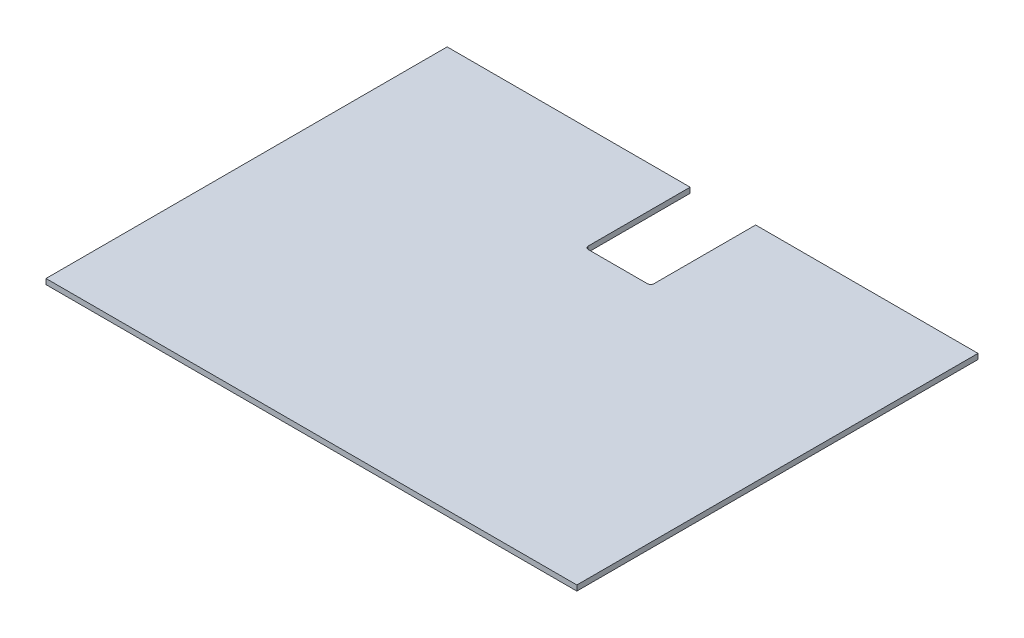
from build123d import *

# Parameters (mm, degrees)
SKETCH_1_W          = 794
SKETCH_1_H          = 8
EXTRUDE_1_DEPTH     = 600
CUT_EXTRUDE_1_DEPTH = 1018.353969246


with BuildPart() as part:
    # 草图1 → 凸台-拉伸1 (new body)
    with BuildSketch(Plane.XY):
        with Locations((424.550423736, 20)):
            Rectangle(SKETCH_1_W, SKETCH_1_H)
    extrude(amount=-EXTRUDE_1_DEPTH)

    # 草图2 → 切除-拉伸1 (cut, through all)
    with BuildSketch(Plane.XZ.offset(-16)):
        with BuildLine():
            Line((396, -443), (484, -443))
            ThreePointArc((484, -443), (487.535533906, -444.464466094), (489, -448))
            Line((489, -448), (489, -603))
            Line((489, -603), (391, -603))
            Line((391, -603), (391, -448))
            ThreePointArc((391, -448), (392.464466094, -444.464466094), (396, -443))
        make_face()
    extrude(amount=-CUT_EXTRUDE_1_DEPTH, mode=Mode.SUBTRACT)


solid = part.part
